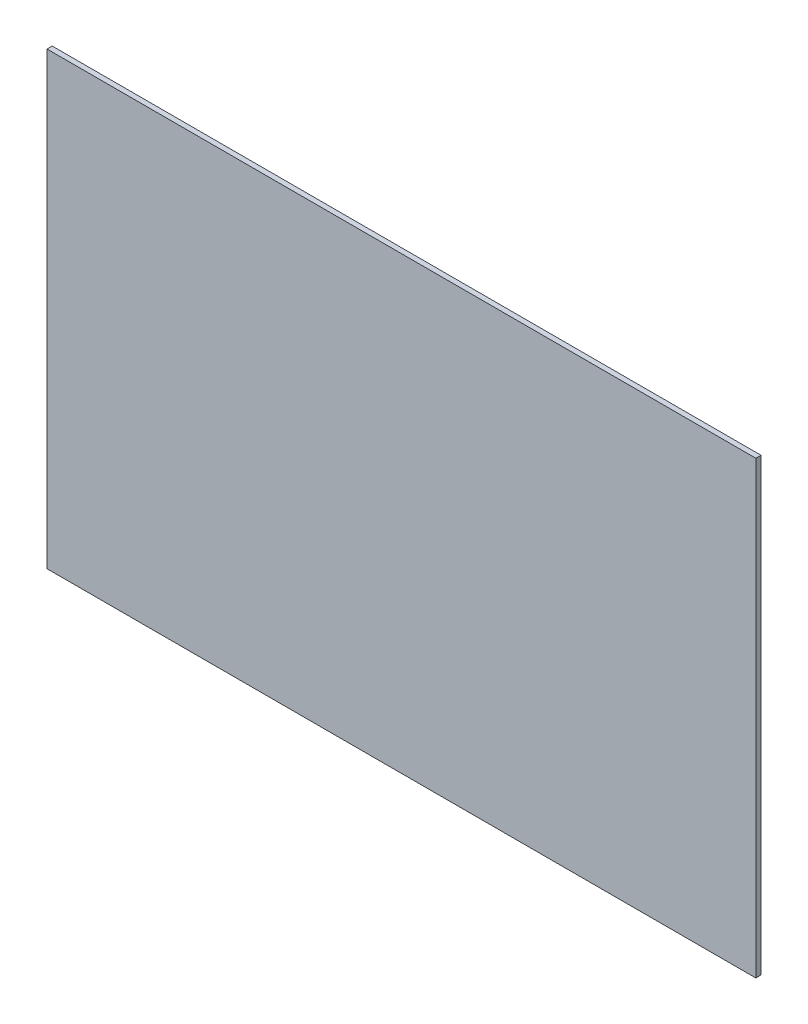
from build123d import *

# Parameters (mm, degrees)
ESQUISSE1_W        = 548
ESQUISSE1_H        = 348
BOSS_EXTRU_1_DEPTH = 4


with BuildPart() as part:
    # Esquisse1 → Boss.-Extru.1 (new body)
    with BuildSketch(Plane.XY):
        Rectangle(ESQUISSE1_W, ESQUISSE1_H)
    extrude(amount=BOSS_EXTRU_1_DEPTH)


solid = part.part
